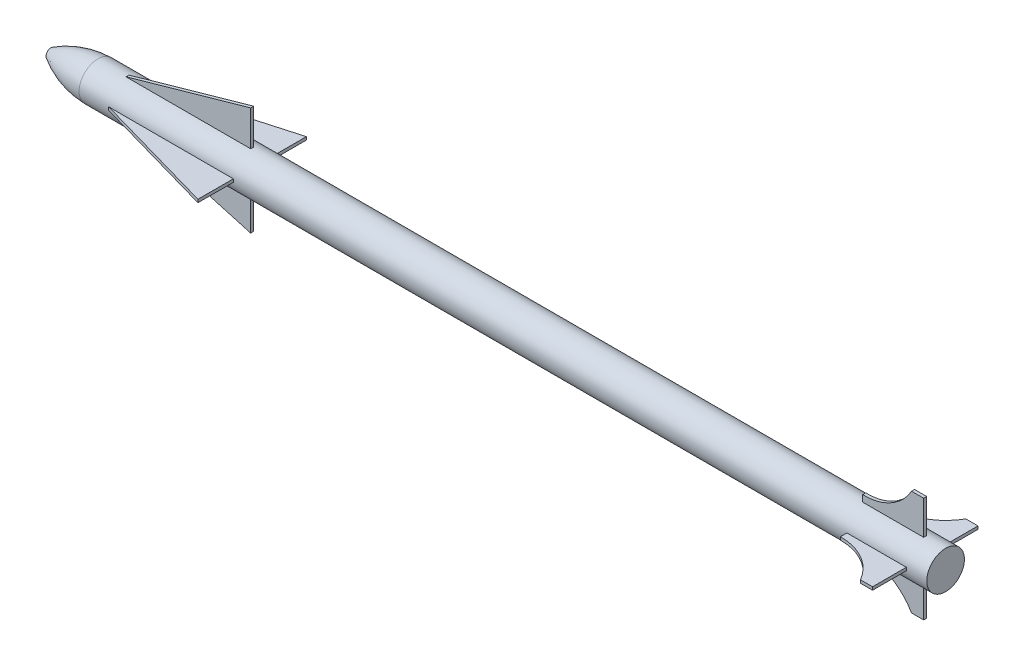
from build123d import *

# Parameters (mm, degrees)
BOSS_EXTRUDE2_START   = 3017.52
SKETCH4_R             = 16.398945734
BOSS_EXTRUDE2_DEPTH   = 3017.52
BOSS_EXTRUDE3_DEPTH   = 5.08
BOSS_EXTRUDE3_2_DEPTH = 5.08
BOSS_EXTRUDE4_DEPTH   = 5.08
BOSS_EXTRUDE5_DEPTH   = 5.08
BOSS_EXTRUDE5_2_DEPTH = 5.08
BOSS_EXTRUDE6_DEPTH   = 5.08


with BuildPart() as part:
    # Sketch1 → Revolve4 (revolve)
    with BuildSketch(Plane.XY):
        with BuildLine():
            Line((3017.52, 63.5), (158.730277168, 63.5))
            add(Edge.make_bspline(
                [(0, 16.398945734), (72.649922377, 61.029885538), (158.730277168, 63.5)],
                knots=[0, 0, 0, 1, 1, 1], degree=2))
            Line((0, 16.398945734), (3017.52, 16.398945734))
            Line((3017.52, 16.398945734), (3017.52, 63.5))
        make_face()
    revolve(axis=Axis((0, 0, 0), (1, 0, 0)))

    # Sketch4 → Boss-Extrude2 (add)
    with BuildSketch(Plane(origin=(0, 0, 0), x_dir=(0, 0, -1), z_dir=(1, 0, 0)).offset(BOSS_EXTRUDE2_START)):
        Circle(SKETCH4_R)
    extrude(amount=-BOSS_EXTRUDE2_DEPTH)

    # Sketch7 → Boss-Extrude4 (add, symmetric)
    with BuildSketch(Plane(origin=(0, 0, 0), x_dir=(1, 0, 0), z_dir=(0, 1, 0))):
        with BuildLine():
            Line((2742.690743974, 64.10161135), (2948.339123975, 64.10161135))
            Line((2948.339123975, 64.10161135), (2948.339123975, 178.40161135))
            Line((2948.339123975, 178.40161135), (2907.479013417, 178.40161135))
            ThreePointArc((2907.479013417, 178.40161135), (2837.818453284, 109.513208892), (2742.690743974, 86.084069922))
            Line((2742.690743974, 86.084069922), (2742.690743974, 64.10161135))
        make_face()
        with BuildLine():
            Line((2948.339123975, -177.19838865), (2948.339123975, -62.89838865))
            Line((2948.339123975, -62.89838865), (2747.896846012, -62.89838865))
            Line((2747.896846012, -62.89838865), (2747.896846012, -84.99638865))
            ThreePointArc((2747.896846012, -84.99638865), (2840.048456129, -109.703930927), (2907.479013515, -177.19838865))
            Line((2907.479013515, -177.19838865), (2948.339123975, -177.19838865))
        make_face()
    extrude(amount=BOSS_EXTRUDE4_DEPTH, both=True)


with BuildPart() as body_2:
    # Sketch5 → Boss-Extrude3 (new, symmetric)
    with BuildSketch(Plane.XY):
        with BuildLine():
            Line((2742.936552939, 63.5), (2948.58493294, 63.5))
            Line((2948.58493294, 63.5), (2948.58493294, 177.8))
            Line((2948.58493294, 177.8), (2907.724822382, 177.8))
            ThreePointArc((2907.724822382, 177.8), (2838.064262249, 108.911597541), (2742.936552939, 85.482458571))
            Line((2742.936552939, 85.482458571), (2742.936552939, 63.5))
        make_face()
    extrude(amount=BOSS_EXTRUDE3_DEPTH, both=True)


with BuildPart() as body_3:
    # Sketch5 → Boss-Extrude3 2 (new, symmetric)
    with BuildSketch(Plane.XY):
        with BuildLine():
            Line((2948.58493294, -177.8), (2948.58493294, -63.5))
            Line((2948.58493294, -63.5), (2748.142654977, -63.5))
            Line((2748.142654977, -63.5), (2748.142654977, -85.598))
            ThreePointArc((2748.142654977, -85.598), (2840.294265094, -110.305542277), (2907.72482248, -177.8))
            Line((2907.72482248, -177.8), (2948.58493294, -177.8))
        make_face()
    extrude(amount=BOSS_EXTRUDE3_2_DEPTH, both=True)


with BuildPart() as boss_extrude4_piece_1:
    # of the separate pieces the step leaves, piece 1, a body of its own (boss_extrude4_pieces)
    add(part.part.solids().sort_by_distance((3017.52, 63.5, 0))[0])

    # Sketch10 → Boss-Extrude6 (add, symmetric)
    with BuildSketch(Plane(origin=(0, 0, 0), x_dir=(1, 0, 0), z_dir=(0, 1, 0))):
        Polygon((678.976478206, 182.803541386), (258.560162791, 63.423541386), (678.976478206, 63.423541386), align=None)
        Polygon((678.976478206, -63.576458614), (258.560162791, -63.576458614), (678.976478206, -182.956458614), align=None)
    extrude(amount=BOSS_EXTRUDE6_DEPTH, both=True)


with BuildPart() as boss_extrude4_piece_2:
    # of the separate pieces the step leaves, piece 2, a body of its own (boss_extrude4_pieces)
    add(part.part.solids().sort_by_distance((2742.690743974, -5.08, -86.084069922))[0])


with BuildPart() as body_5:
    # Sketch8 → Boss-Extrude5 (new, symmetric)
    with BuildSketch(Plane.XY):
        Polygon((678.896134422, 182.88), (258.479819006, 63.5), (678.896134422, 63.5), align=None)
    extrude(amount=BOSS_EXTRUDE5_DEPTH, both=True)


with BuildPart() as body_6:
    # Sketch8 → Boss-Extrude5 2 (new, symmetric)
    with BuildSketch(Plane.XY):
        Polygon((678.896134422, -63.5), (258.479819006, -63.5), (678.896134422, -182.88), align=None)
    extrude(amount=BOSS_EXTRUDE5_2_DEPTH, both=True)


with BuildPart() as boss_extrude6_piece_1:
    # of the separate pieces the step leaves, piece 1, a body of its own (boss_extrude6_pieces)
    add(boss_extrude4_piece_1.part.solids().sort_by_distance((3017.52, 63.5, 0))[0])


with BuildPart() as boss_extrude6_piece_2:
    # of the separate pieces the step leaves, piece 2, a body of its own (boss_extrude6_pieces)
    add(boss_extrude4_piece_1.part.solids().sort_by_distance((678.976478206, -5.08, 63.576458614))[0])


solid = Compound([body_2.part, body_3.part, boss_extrude4_piece_2.part, body_5.part, body_6.part, boss_extrude6_piece_1.part, boss_extrude6_piece_2.part])
